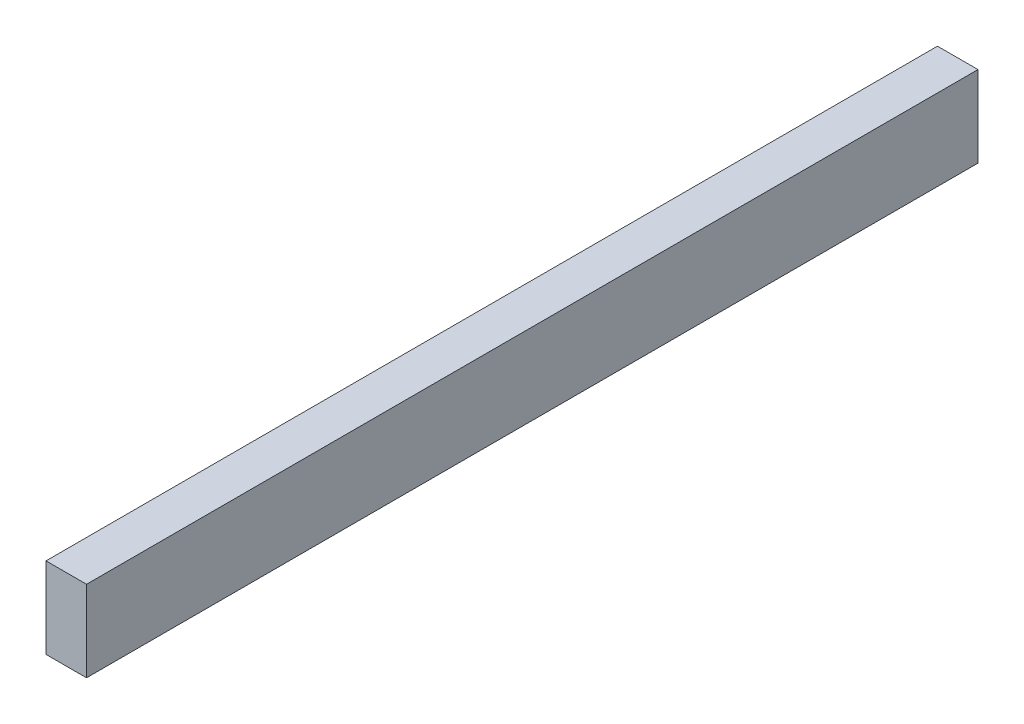
from build123d import *

# Parameters (mm, degrees)
SKETCH1_W           = 3.175
SKETCH1_H           = 6.35
BOSS_EXTRUDE1_DEPTH = 69.85


with BuildPart() as part:
    # Sketch1 → Boss-Extrude1 (new body)
    with BuildSketch(Plane.XY):
        Rectangle(SKETCH1_W, SKETCH1_H)
    extrude(amount=BOSS_EXTRUDE1_DEPTH)


solid = part.part
